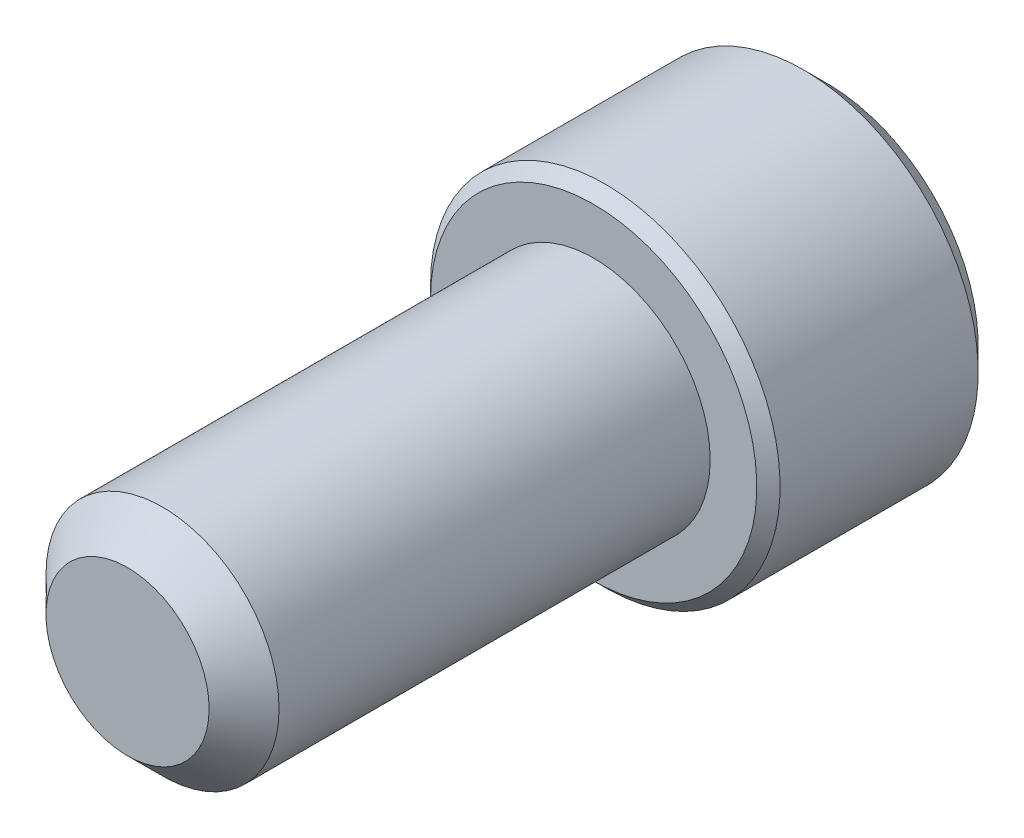
from build123d import *

# Parameters (mm, degrees)
SKETCH1_R          = 3.175
EXTRUDE1_DEPTH     = 12.7
CHAMFER3_SIZE      = 0.9525
SKETCH6_R          = 4.7625
EXTRUDE2_DEPTH     = 6.35
CUT_EXTRUDE1_DEPTH = 3.571875
SKETCH8_R          = 2.749630657
CUT_EXTRUDE2_DEPTH = 0.635
CUT_EXTRUDE2_DRAFT = -45
CHAMFER1_SIZE      = 0.635
CHAMFER2_SIZE      = 0.3175


with BuildPart() as part:
    # Sketch1 → Extrude1 (new body)
    with BuildSketch(Plane.XY):
        Circle(SKETCH1_R)
    extrude(amount=-EXTRUDE1_DEPTH)

    # Chamfer3
    chamfer3_edges = [part.edges().sort_by_distance(p)[0] for p in [
        (-3.175, 0, 0),
    ]]
    chamfer(chamfer3_edges, length=CHAMFER3_SIZE)

    # Sketch6 → Extrude2 (add)
    with BuildSketch(Plane(origin=(0, 0, -12.7), x_dir=(-1, 0, 0), z_dir=(0, 0, -1))):
        Circle(SKETCH6_R)
    extrude(amount=EXTRUDE2_DEPTH)

    # Sketch7 → Cut-Extrude1 (cut)
    with BuildSketch(Plane(origin=(0, 0, -19.05), x_dir=(-1, 0, 0), z_dir=(0, 0, -1))):
        Polygon((0, 2.749630657), (-2.38125, 1.374815329), (-2.38125, -1.374815329), (0, -2.749630657), (2.38125, -1.374815329), (2.38125, 1.374815329), align=None)
    extrude(amount=-CUT_EXTRUDE1_DEPTH, mode=Mode.SUBTRACT)


with BuildPart() as cut_extrude2_tool:
    # Sketch8 → Cut-Extrude2 (with draft: the straight prism first)
    with BuildSketch(Plane(origin=(0, 0, -19.05), x_dir=(-1, 0, 0), z_dir=(0, 0, -1))):
        Circle(SKETCH8_R)
    extrude(amount=-CUT_EXTRUDE2_DEPTH)
    # Cut-Extrude2: the draft: its side faces are tilted about the plane it starts from
    cut_extrude2_sides = [cut_extrude2_tool.faces().sort_by_distance(p)[0] for p in [
        (2.749630657, 0, -18.7325),
    ]]
    draft(cut_extrude2_sides, Plane(origin=(0, 0, -19.05), x_dir=(-1, 0, 0), z_dir=(0, 0, -1)), CUT_EXTRUDE2_DRAFT)


with BuildPart() as part_1:
    add(part.part)

    # Cut-Extrude2: cut by cut_extrude2_tool
    add(cut_extrude2_tool.part, mode=Mode.SUBTRACT)

    # Chamfer1
    chamfer1_edges = [part_1.edges().sort_by_distance(p)[0] for p in [
        (4.7625, 0, -19.05),
    ]]
    chamfer(chamfer1_edges, length=CHAMFER1_SIZE)

    # Chamfer2
    chamfer2_edges = [part_1.edges().sort_by_distance(p)[0] for p in [
        (4.7625, 0, -12.7),
    ]]
    chamfer(chamfer2_edges, length=CHAMFER2_SIZE)


solid = part_1.part
